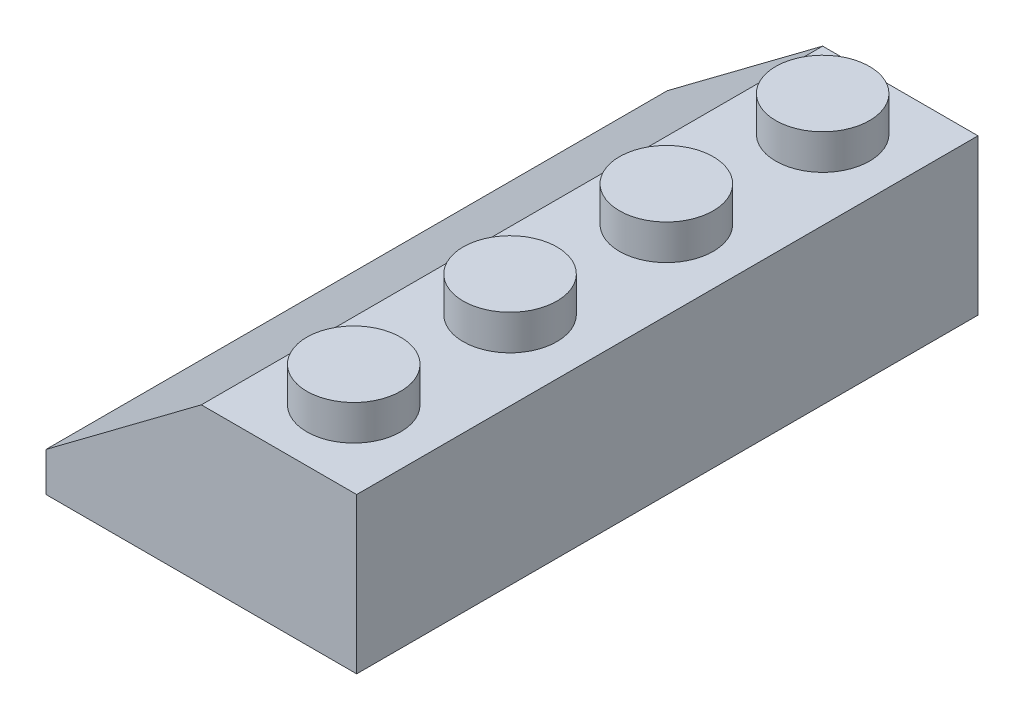
from build123d import *

# Parameters (mm, degrees)
BOSS_EXTRUDE1_DEPTH = 15.9
SKETCH2_R           = 2.4
BOSS_EXTRUDE2_DEPTH = 1.8
LPATTERN1_COUNT     = 4
LPATTERN1_PITCH     = 8
SHELL1_T            = -1.2
SKETCH3_R           = 3.25
SKETCH3_R_2         = 2.4
BOSS_EXTRUDE3_DEPTH = 6.75
LPATTERN3_COUNT     = 2
LPATTERN3_PITCH     = 8
LPATTERN3_COL_COUNT = 2
LPATTERN3_COL_PITCH = 8
SKETCH4_W           = 9.930005036
SKETCH4_H           = 31.8
CUT_EXTRUDE1_DEPTH  = 21.430775863


with BuildPart() as part:
    # Sketch1 → Boss-Extrude1 (new, symmetric)
    with BuildSketch(Plane.XY):
        Polygon((0, 0), (-15.9, 0), (-15.9, 2), (-7.95, 7.95), (0, 7.95), align=None)
    extrude(amount=BOSS_EXTRUDE1_DEPTH, both=True)

    # Sketch2 → Boss-Extrude2 (add)
    with BuildSketch(Plane(origin=(0, 7.95, 0), x_dir=(1, 0, 0), z_dir=(0, 1, 0))):
        with Locations(Location((-4.05, -12, 0), (0, 0, 270))):
            Circle(SKETCH2_R)
    boss_extrude2 = extrude(amount=BOSS_EXTRUDE2_DEPTH)

    # LPattern1: Boss-Extrude2 ×4
    with Locations(*[(0, 0, -i * LPATTERN1_PITCH) for i in range(1, LPATTERN1_COUNT)]):
        add(boss_extrude2)

    # Shell1
    shell1_openings = [part.faces().sort_by_distance(p)[0] for p in [
        (-7.95, 0, 0),
    ]]
    offset(amount=SHELL1_T, openings=shell1_openings, kind=Kind.INTERSECTION)

    # Sketch3 → Boss-Extrude3 (add)
    with BuildSketch(Plane.XZ.offset(-6.75)):
        with Locations(Location((-8.015401462, 0, 0), (0, 0, 81.778871815))):
            Circle(SKETCH3_R)
        with Locations(Location((-8.015401462, 0, 0), (0, 0, 78.834853806))):
            Circle(SKETCH3_R_2, mode=Mode.SUBTRACT)
    boss_extrude3 = extrude(amount=BOSS_EXTRUDE3_DEPTH)

    # LPattern3: Boss-Extrude3 ×2
    with Locations(*[(0, 0, -i * LPATTERN3_PITCH) for i in range(1, LPATTERN3_COUNT)]):
        add(boss_extrude3)

    # LPattern3 col: Boss-Extrude3 ×2
    with Locations(*[(0, 0, i * LPATTERN3_COL_PITCH) for i in range(1, LPATTERN3_COL_COUNT)]):
        add(boss_extrude3)

    # Sketch4 → Cut-Extrude1 (cut, through all)
    with BuildSketch(Plane(origin=(-6.668067035, 8.909434106, 0), x_dir=(0.8006038236418165, 0.5991940566879009, 0), z_dir=(-0.5991940566879009, 0.8006038236418165, 0))):
        with Locations((-6.566210165, 0)):
            Rectangle(SKETCH4_W, SKETCH4_H)
    extrude(amount=CUT_EXTRUDE1_DEPTH, mode=Mode.SUBTRACT)


solid = part.part
